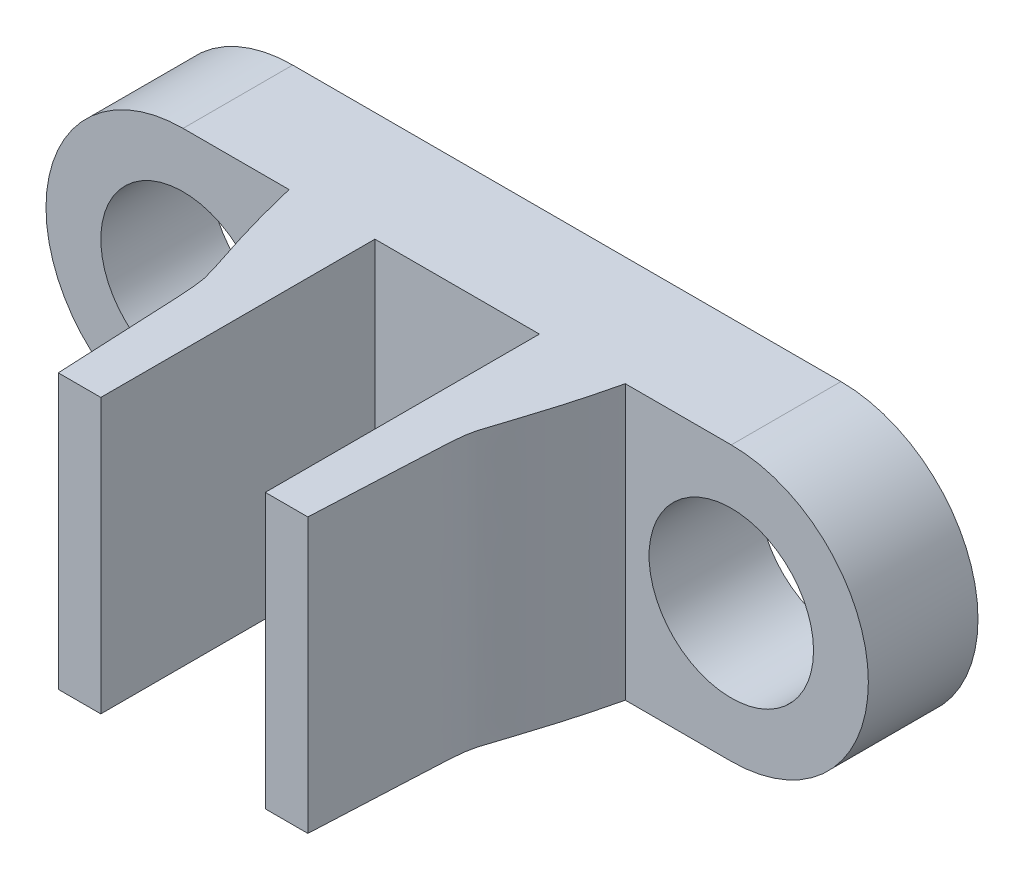
from build123d import *

# Parameters (mm, degrees)
SKETCH1_R           = 1.5
BOSS_EXTRUDE1_DEPTH = 2
BOSS_EXTRUDE2_DEPTH = 5


with BuildPart() as part:
    # Sketch1 → Boss-Extrude1 (new body)
    with BuildSketch(Plane.XY):
        with BuildLine():
            Line((0, 0), (10, 0))
            ThreePointArc((10, 0), (12.5, 2.5), (10, 5))
            Line((10, 5), (0, 5))
            ThreePointArc((0, 5), (-2.5, 2.5), (0, 0))
        make_face()
        with Locations((0, 2.5)):
            Circle(SKETCH1_R, mode=Mode.SUBTRACT)
        with Locations((10, 2.5)):
            Circle(SKETCH1_R, mode=Mode.SUBTRACT)
    extrude(amount=BOSS_EXTRUDE1_DEPTH)

    # Sketch2 → Boss-Extrude2 (add)
    with BuildSketch(Plane(origin=(0, 0, 0), x_dir=(1, 0, 0), z_dir=(0, 1, 0))):
        with BuildLine():
            Line((2.723714879, -2), (3.5, -2))
            Line((3.5, -2), (3.5, -7))
            Line((3.5, -7), (2.723714879, -7))
            add(Edge.make_bspline(
                [(2.723714879, -7), (2.623482732, -5.096496359), (2.626841272, -4.377777821), (2.43389568, -3.713843944), (2.176399926, -3.027645535), (1.933254484, -2)],
                knots=[0, 0, 0, 0, 0.37067554, 0.47067554, 1, 1, 1, 1], degree=3))
            Line((1.933254484, -2), (2.723714879, -2))
        make_face()
        with BuildLine():
            Line((8.066745516, -2), (7.276285121, -2))
            Line((7.276285121, -2), (6.5, -2))
            Line((6.5, -2), (6.5, -7))
            Line((6.5, -7), (7.276285121, -7))
            add(Edge.make_bspline(
                [(7.276285121, -7), (7.376517268, -5.096496359), (7.373158728, -4.377777821), (7.56610432, -3.713843944), (7.823600074, -3.027645535), (8.066745516, -2)],
                knots=[0, 0, 0, 0, 0.37067554, 0.47067554, 1, 1, 1, 1], degree=3))
        make_face()
    extrude(amount=BOSS_EXTRUDE2_DEPTH)


solid = part.part
